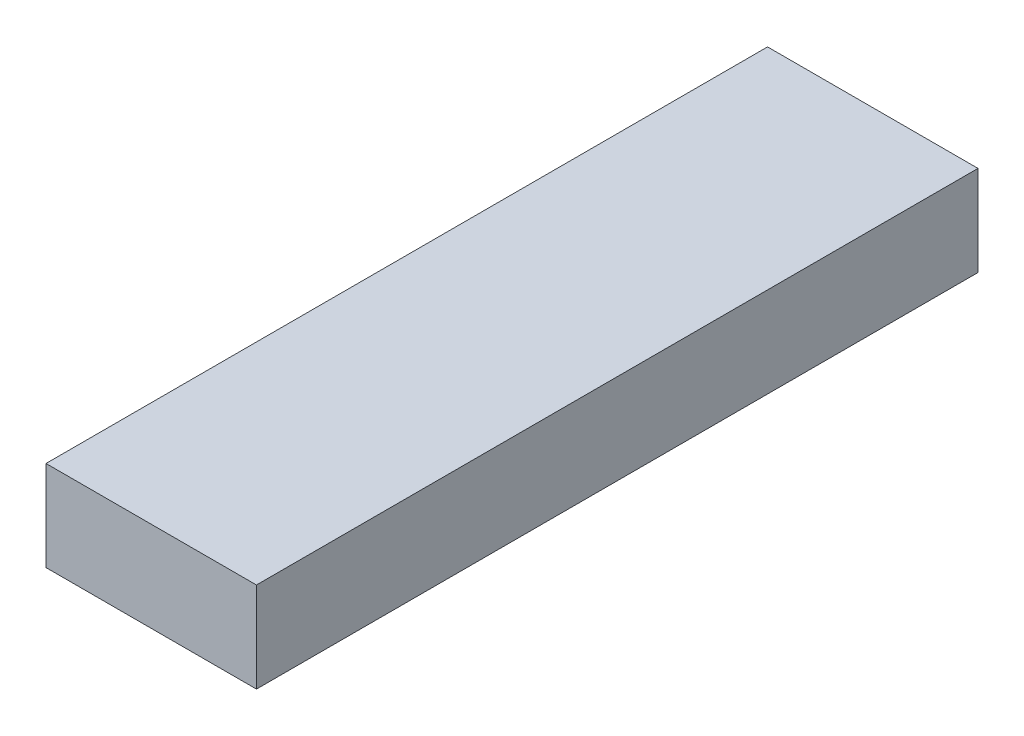
from build123d import *

# Parameters (mm, degrees)
SKETCH1_W           = 88.9
SKETCH1_H           = 38.1
BOSS_EXTRUDE1_DEPTH = 304.8


with BuildPart() as part:
    # Sketch1 → Boss-Extrude1 (new body)
    with BuildSketch(Plane.XY):
        Rectangle(SKETCH1_W, SKETCH1_H)
    extrude(amount=BOSS_EXTRUDE1_DEPTH)


solid = part.part
